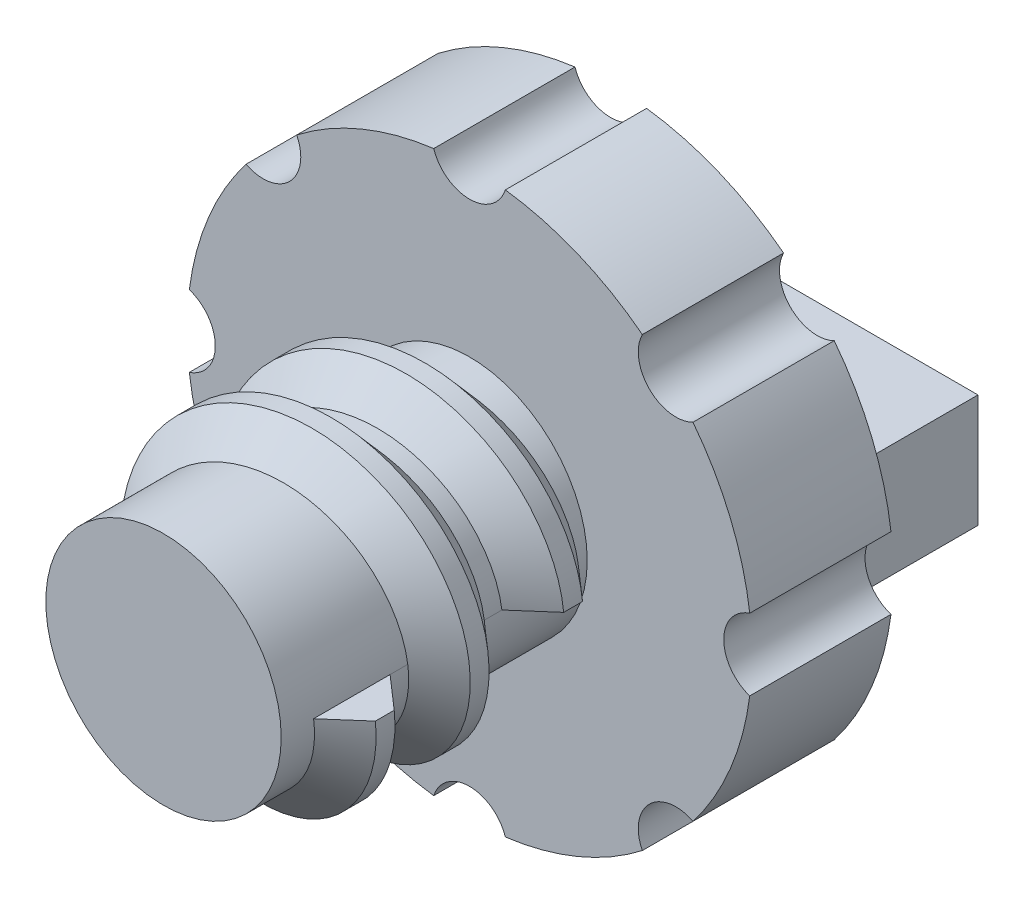
from build123d import *

# Parameters (mm, degrees)
FINGER_GRIP_HEAD_D12_START       = -3
SKETCH1_R                        = 6
FINGER_GRIP_HEAD_D12_DEPTH       = 3
SKETCH2_R                        = 2.5
CORE_D5_DEPTH                    = 6.5
COARSE_THREAD_D6P4_P2_PITCH      = 2
COARSE_THREAD_D6P4_P2_HEIGHT     = 4
COARSE_THREAD_D6P4_P2_RADIUS     = 2.45
FINGER_GRIP_FLUTES_START         = -3
SKETCH4_R                        = 0.8
FINGER_GRIP_FLUTES_DEPTH         = 3
RAISED_FINGER_TURNING_GRIP_START = -6
SKETCH5_W                        = 9.6
SKETCH5_H                        = 2.4
RAISED_FINGER_TURNING_GRIP_DEPTH = 3.1


with BuildPart() as part:
    # Sketch1 → Finger_grip_head_D12 (new body)
    with BuildSketch(Plane.XY.offset(FINGER_GRIP_HEAD_D12_START)):
        Circle(SKETCH1_R)
    extrude(amount=FINGER_GRIP_HEAD_D12_DEPTH)

    # Sketch2 → Core_D5 (add)
    with BuildSketch(Plane.XY):
        with Locations(Location((0, 0, 0), (0, 0, 180))):
            Circle(SKETCH2_R)
    extrude(amount=CORE_D5_DEPTH)

    # Coarse_thread_D6p4_P2: sweep along a helix
    with BuildLine() as coarse_thread_d6p4_p2_path:
        Helix(COARSE_THREAD_D6P4_P2_PITCH, COARSE_THREAD_D6P4_P2_HEIGHT, COARSE_THREAD_D6P4_P2_RADIUS, center=(0, 0, 1), direction=(0, 0, 1))
    # 3DSketch1 → Coarse_thread_D6p4_P2 (sweep)
    with BuildSketch(Plane(origin=(2.4, 0, 0.1), x_dir=(0, 0, 1), z_dir=(0, 1, 0))):
        Polygon((0, 0), (0.7, 0.8), (1.1, 0.8), (1.8, 0), align=None)
    sweep(path=coarse_thread_d6p4_p2_path.line, is_frenet=True)

    # Sketch4 → Finger_grip_flutes (cut)
    with BuildSketch(Plane.XY.offset(FINGER_GRIP_FLUTES_START)):
        with Locations((6.2, 0)):
            Circle(SKETCH4_R)
        with Locations((4.384062043, 4.384062043)):
            Circle(SKETCH4_R)
        with Locations((0, 6.2)):
            Circle(SKETCH4_R)
        with Locations((-4.384062043, 4.384062043)):
            Circle(SKETCH4_R)
        with Locations((-6.2, 0)):
            Circle(SKETCH4_R)
        with Locations((-4.384062043, -4.384062043)):
            Circle(SKETCH4_R)
        with Locations((0, -6.2)):
            Circle(SKETCH4_R)
        with Locations((4.384062043, -4.384062043)):
            Circle(SKETCH4_R)
    extrude(amount=FINGER_GRIP_FLUTES_DEPTH, mode=Mode.SUBTRACT)

    # Sketch5 → Raised_finger_turning_grip (add)
    with BuildSketch(Plane.XY.offset(RAISED_FINGER_TURNING_GRIP_START)):
        Rectangle(SKETCH5_W, SKETCH5_H)
    extrude(amount=RAISED_FINGER_TURNING_GRIP_DEPTH)


solid = part.part
